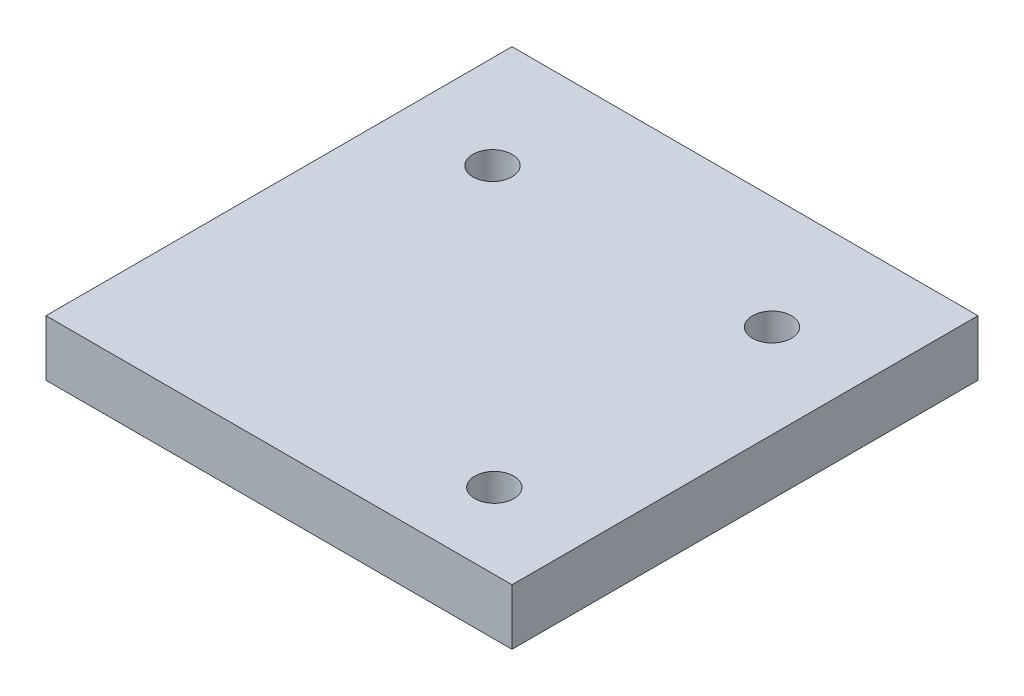
from build123d import *

# Parameters (mm, degrees)
SKETCH_1_W          = 50
SKETCH_1_H          = 50
EXTRUDE_1_DEPTH     = 6
CUT_EXTRUDE_1_REACH = 37.861
SKETCH_2_R          = 2.1
CUT_EXTRUDE_2_REACH = 37.861
SKETCH_3_R          = 2.1


with BuildPart() as part:
    # 草图1 → 凸台-拉伸1 (new body)
    with BuildSketch(Plane(origin=(0, 0, 0), x_dir=(1, 0, 0), z_dir=(0, 1, 0))):
        Rectangle(SKETCH_1_W, SKETCH_1_H)
    extrude(amount=EXTRUDE_1_DEPTH)

    # 草图2 → 切除-拉伸1 (cut, up to next)
    with BuildSketch(Plane(origin=(0, 6, 0), x_dir=(1, 0, 0), z_dir=(0, 1, 0)), mode=Mode.PRIVATE) as cut_extrude_1_sk1:
        with Locations(Location((-15, 12.9, 0), (0, 0, 270))):
            Circle(SKETCH_2_R)
    cut_extrude_1_tool1 = extrude(cut_extrude_1_sk1.sketch, amount=-CUT_EXTRUDE_1_REACH, mode=Mode.PRIVATE) & part.part
    # 草图2 → 切除-拉伸1 (cut, up to next)
    with BuildSketch(Plane(origin=(0, 6, 0), x_dir=(1, 0, 0), z_dir=(0, 1, 0)), mode=Mode.PRIVATE) as cut_extrude_1_sk2:
        with Locations(Location((15, 12.9, 0), (0, 0, 270))):
            Circle(SKETCH_2_R)
    cut_extrude_1_tool2 = extrude(cut_extrude_1_sk2.sketch, amount=-CUT_EXTRUDE_1_REACH, mode=Mode.PRIVATE) & part.part
    add(cut_extrude_1_tool1.solids().sort_by_distance((-15, 6, -12.9))[0], mode=Mode.SUBTRACT)
    add(cut_extrude_1_tool2.solids().sort_by_distance((15, 6, -12.9))[0], mode=Mode.SUBTRACT)

    # 草图3 → 切除-拉伸2 (cut, up to next)
    with BuildSketch(Plane(origin=(0, 6, 0), x_dir=(1, 0, 0), z_dir=(0, 1, 0)), mode=Mode.PRIVATE) as cut_extrude_2_sk1:
        with Locations(Location((15, -16.9, 0), (0, 0, 270))):
            Circle(SKETCH_3_R)
    cut_extrude_2_tool1 = extrude(cut_extrude_2_sk1.sketch, amount=-CUT_EXTRUDE_2_REACH, mode=Mode.PRIVATE) & part.part
    add(cut_extrude_2_tool1.solids().sort_by_distance((15, 6, 16.9))[0], mode=Mode.SUBTRACT)


solid = part.part
